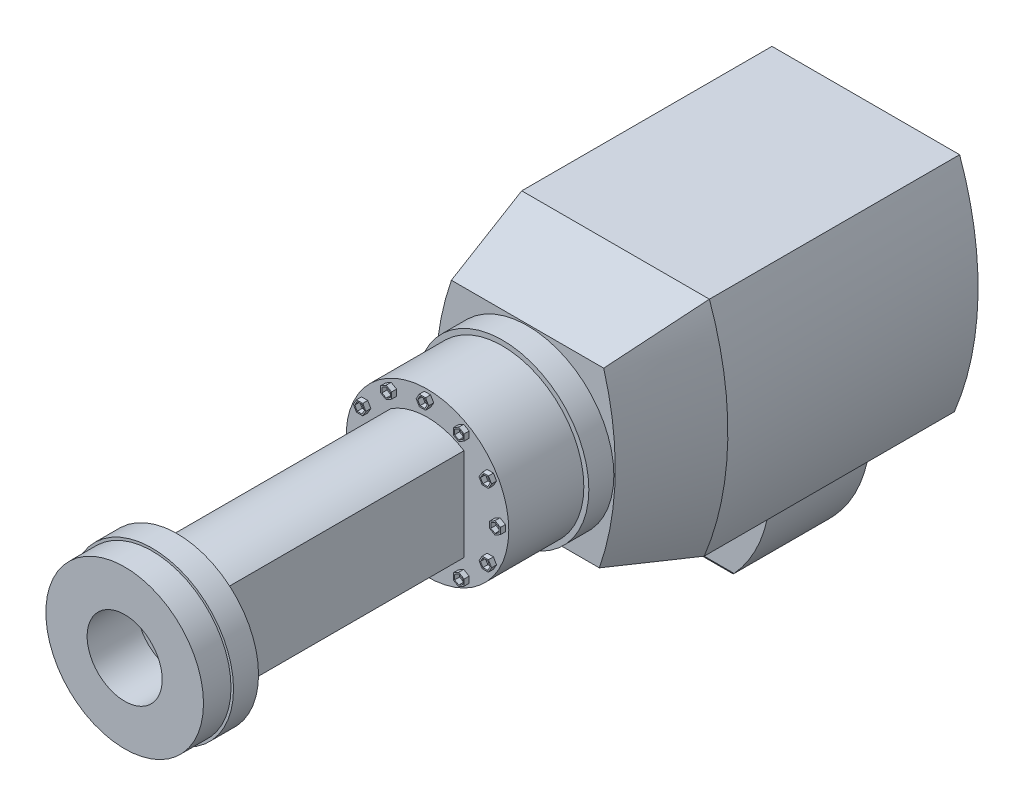
from build123d import *

# Parameters (mm, degrees)
BOSS_EXTRUDE1_DEPTH  = 100
SKETCH5_R            = 34.5
BOSS_EXTRUDE2_DEPTH  = 10
SKETCH6_R            = 32.5
BOSS_EXTRUDE3_DEPTH  = 30
BOSS_EXTRUDE4_DEPTH  = 2
CIRPATTERN1_COUNT    = 12
BOSS_EXTRUDE5_DEPTH  = 100
SKETCH9_R            = 32.5
BOSS_EXTRUDE6_DEPTH  = 10
SKETCH10_R           = 31.5
BOSS_EXTRUDE7_DEPTH  = 1
SKETCH11_R           = 31.5
BOSS_EXTRUDE8_DEPTH  = 10
SKETCH12_R           = 42.5
BOSS_EXTRUDE9_DEPTH  = 10.5
BOSS_EXTRUDE10_DEPTH = 35
BOSS_EXTRUDE12_DEPTH = 20
CUT_EXTRUDE1_DEPTH   = 40
SKETCH16_R           = 15
CUT_EXTRUDE2_DEPTH   = 20
SKETCH17_R           = 15
CUT_EXTRUDE3_DEPTH   = 20


with BuildPart() as part:
    # Sketch1 → Boss-Extrude1 (new body)
    with BuildSketch(Plane.XY):
        with BuildLine():
            Line((-28.400721843, 45), (46.599278157, 45))
            ThreePointArc((46.599278157, 45), (53.94000781, -0.194241544), (44.513991163, -45))
            Line((44.513991163, -45), (-30.486008837, -45))
            ThreePointArc((-30.486008837, -45), (-37.82673849, 0.194241544), (-28.400721843, 45))
        make_face()
    extrude(amount=BOSS_EXTRUDE1_DEPTH)

    # Sketch3 → section 0 of loft2
    with BuildSketch(Plane.XY.offset(135), mode=Mode.PRIVATE) as loft2_s0:
        with BuildLine():
            Line((-23.231416865, -35), (37.618006151, -35))
            ThreePointArc((37.618006151, -35), (43.938576805, -0.134612731), (39.344686186, 35))
            Line((39.344686186, 35), (-21.50473683, 35))
            ThreePointArc((-21.50473683, 35), (-27.825307484, 0.134612731), (-23.231416865, -35))
        make_face()
    # loft up to a face of the part (loft2)
    loft([loft2_s0.sketch, part.faces().sort_by_distance((8.05663466, 0, 100))[0]])

    # Sketch5 → Boss-Extrude2 (add)
    with BuildSketch(Plane.XY.offset(135)):
        with Locations((8.919974678, 0)):
            Circle(SKETCH5_R)
    extrude(amount=BOSS_EXTRUDE2_DEPTH)

    # Sketch6 → Boss-Extrude3 (add)
    with BuildSketch(Plane.XY.offset(145)):
        with Locations((8.919974678, 0)):
            Circle(SKETCH6_R)
    extrude(amount=BOSS_EXTRUDE3_DEPTH)

    # Sketch7 → Boss-Extrude4 (add)
    with BuildSketch(Plane.XY.offset(175)):
        Polygon((37.917079394, 2.499998323), (35.753464978, 1.247491772), (35.756360262, -1.252506551), (37.922869962, -2.499998323), (40.086484377, -1.247491772), (40.083589093, 1.252506551), align=None)
        Polygon((39.583923747, 0.963252553), (37.917748031, 1.922648441), (36.253798962, 0.959395888), (36.256025608, -0.963252553), (37.922201324, -1.922648441), (39.586150394, -0.959395888), align=None, mode=Mode.SUBTRACT)
    boss_extrude4 = extrude(amount=BOSS_EXTRUDE4_DEPTH)

    # CirPattern1: Boss-Extrude4 ×12 about axis
    cirpattern1_axis = Axis((8.919974678, 0, 0), (0, 0, 1))
    for i in range(1, CIRPATTERN1_COUNT):
        add(boss_extrude4.rotate(cirpattern1_axis, i * 360 / CIRPATTERN1_COUNT))

    # Sketch8 → Boss-Extrude5 (add)
    with BuildSketch(Plane.XY.offset(175)):
        with BuildLine():
            Line((23.504312991, 18.5), (23.504312991, -18.5))
            ThreePointArc((23.504312991, -18.5), (8.919974678, -22.777828538), (-5.664363636, -18.5))
            Line((-5.664363636, -18.5), (-5.664363636, 18.5))
            ThreePointArc((-5.664363636, 18.5), (8.919974678, 22.777828538), (23.504312991, 18.5))
        make_face()
    extrude(amount=BOSS_EXTRUDE5_DEPTH)

    # Sketch9 → Boss-Extrude6 (add)
    with BuildSketch(Plane.XY.offset(275)):
        with Locations((8.919974678, 0)):
            Circle(SKETCH9_R)
    extrude(amount=BOSS_EXTRUDE6_DEPTH)

    # Sketch10 → Boss-Extrude7 (add)
    with BuildSketch(Plane.XY.offset(285)):
        with Locations((8.919974678, 0)):
            Circle(SKETCH10_R)
    extrude(amount=BOSS_EXTRUDE7_DEPTH)

    # Sketch11 → Boss-Extrude8 (add)
    with BuildSketch(Plane.XY.offset(286)):
        with Locations((8.919974678, 0)):
            Circle(SKETCH11_R)
    extrude(amount=BOSS_EXTRUDE8_DEPTH)

    # Sketch12 → Boss-Extrude9 (add, symmetric)
    with BuildSketch(Plane(origin=(-35, 0, 0), x_dir=(0, 0, -1), z_dir=(1, 0, 0))):
        with Locations((-50, -45)):
            Circle(SKETCH12_R)
    extrude(amount=BOSS_EXTRUDE9_DEPTH, both=True)

    # Sketch13 → Boss-Extrude10 (add)
    with BuildSketch(Plane(origin=(-24.5, 0, 0), x_dir=(0, 0, -1), z_dir=(1, 0, 0))):
        with BuildLine():
            Line((-70, -45), (-70, -75))
            ThreePointArc((-70, -75), (-50, -85), (-30, -75))
            Line((-30, -75), (-30, -45))
            Line((-30, -45), (-70, -45))
        make_face()
    extrude(amount=BOSS_EXTRUDE10_DEPTH)

    # Sketch14 → Boss-Extrude12 (add, symmetric)
    with BuildSketch(Plane(origin=(0, 0, 50), x_dir=(-1, 0, 0), z_dir=(0, 0, -1))):
        with BuildLine():
            Line((-10.5, -45), (-10.5, -87))
            ThreePointArc((-10.5, -87), (-30.732682345, -69.737630247), (-40.5, -45))
            Line((-40.5, -45), (-10.5, -45))
        make_face()
    extrude(amount=BOSS_EXTRUDE12_DEPTH, both=True)

    # Sketch15 → Cut-Extrude1 (cut)
    with BuildSketch(Plane.ZY.offset(-10.5)):
        with BuildLine():
            Line((70, -87), (70, -75))
            ThreePointArc((70, -75), (50, -85), (30, -75))
            Line((30, -75), (30, -87))
            Line((30, -87), (70, -87))
        make_face()
    extrude(amount=-CUT_EXTRUDE1_DEPTH, mode=Mode.SUBTRACT)

    # Sketch16 → Cut-Extrude2 (cut)
    with BuildSketch(Plane.XY.offset(296)):
        with Locations((8.919974678, 0)):
            Circle(SKETCH16_R)
    extrude(amount=-CUT_EXTRUDE2_DEPTH, mode=Mode.SUBTRACT)

    # Sketch17 → Cut-Extrude3 (cut)
    with BuildSketch(Plane.ZY.offset(45.5)):
        with Locations((50, -45)):
            Circle(SKETCH17_R)
    extrude(amount=-CUT_EXTRUDE3_DEPTH, mode=Mode.SUBTRACT)


solid = part.part
